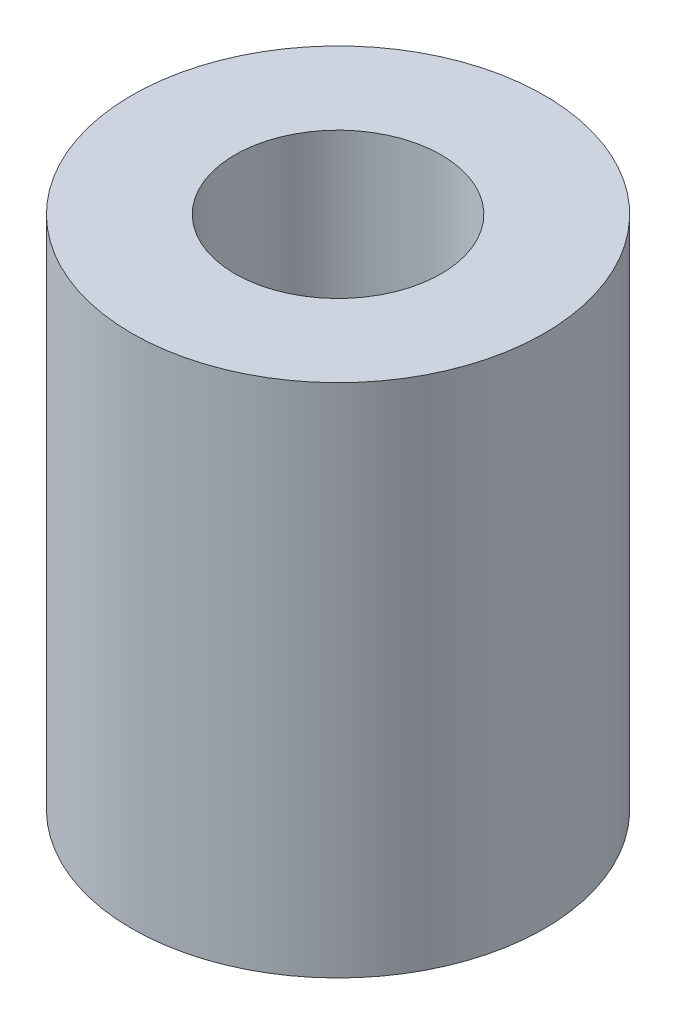
from build123d import *

# Parameters (mm, degrees)
SKETCH_1_R      = 10
SKETCH_1_R_2    = 5
EXTRUDE_1_DEPTH = 12.5


with BuildPart() as part:
    # ｽｹｯﾁ1 → ﾎﾞｽ - 押し出し1 (new, symmetric)
    with BuildSketch(Plane(origin=(0, 0, 0), x_dir=(1, 0, 0), z_dir=(0, 1, 0))):
        with Locations(Location((0, 0, 0), (0, 0, 270))):
            Circle(SKETCH_1_R)
        with Locations(Location((0, 0, 0), (0, 0, 270))):
            Circle(SKETCH_1_R_2, mode=Mode.SUBTRACT)
    extrude(amount=EXTRUDE_1_DEPTH, both=True)


solid = part.part
